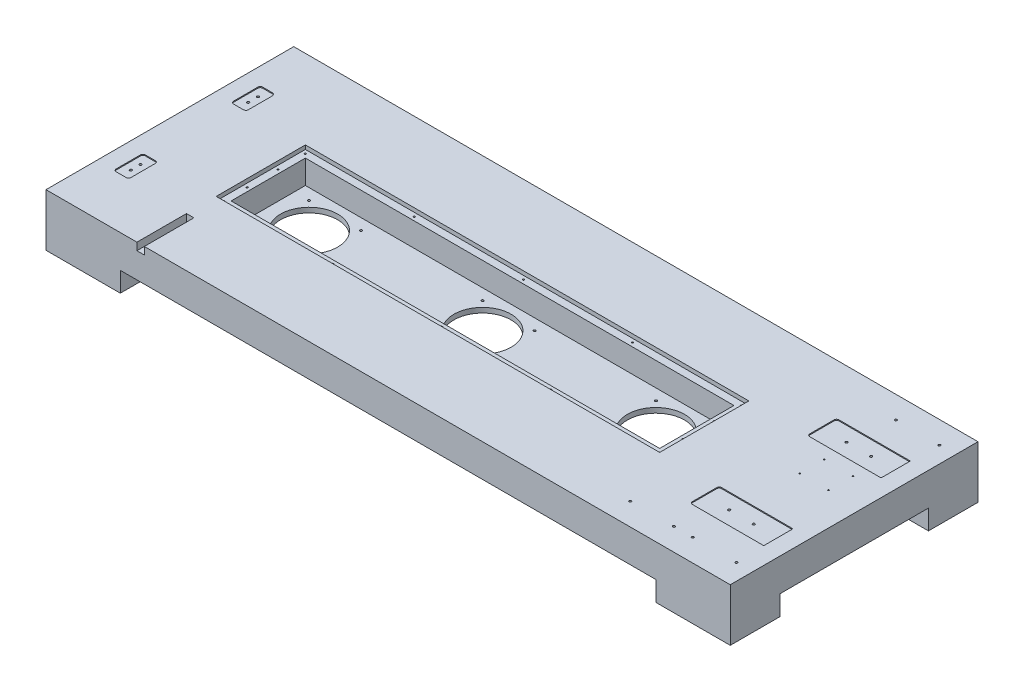
from build123d import *

# Parameters (mm, degrees)
SKETCH19_W               = 895
SKETCH19_H               = 180
SKETCH19_W_2             = 865
SKETCH19_H_2             = 150
BOSS_EXTRUDE2_DEPTH      = 48
SKETCH22_W               = 895
SKETCH22_H               = 180
BOSS_EXTRUDE3_DEPTH      = 10
BOSS_EXTRUDE4_DEPTH      = 56
BOSS_EXTRUDE4_DEPTH_BACK = 10
SKETCH23_W               = 1500
SKETCH23_H               = 500
SKETCH23_W_2             = 895
SKETCH23_H_2             = 180
CUT_EXTRUDE6_START       = 48
SKETCH26_R               = 1.65
CUT_EXTRUDE6_DEPTH       = 20
LPATTERN1_COUNT          = 5
LPATTERN1_PITCH          = 220
SKETCH28_R               = 2.3
SKETCH28_R_2             = 57.7
CUT_EXTRUDE7_DEPTH       = 793.55031386
LPATTERN2_COUNT          = 2
LPATTERN2_PITCH          = 350
LPATTERN2_COL_COUNT      = 2
LPATTERN2_COL_PITCH      = 350
CUT_EXTRUDE8_START       = 48
SKETCH27_R               = 1.65
CUT_EXTRUDE8_DEPTH       = 20
CUT_EXTRUDE9_START       = -56
CUT_EXTRUDE9_DEPTH       = 2
CUT_EXTRUDE10_START      = 56
CUT_EXTRUDE10_DEPTH      = 2
CUT_EXTRUDE11_DEPTH      = 793.55031386
CUT_EXTRUDE11_DEPTH_BACK = 793.55031386
SKETCH33_R               = 2.35
CUT_EXTRUDE12_DEPTH      = 793.55031386
CUT_EXTRUDE12_DEPTH_BACK = 793.55031386
SKETCH34_W               = 190.830831748
SKETCH34_H               = 540.530008981
SKETCH29_W               = 150
SKETCH29_H               = 100
BOSS_EXTRUDE5_DEPTH      = 50
CUT_EXTRUDE13_START      = 56
SKETCH35_W               = 15
SKETCH35_H               = 100
CUT_EXTRUDE13_DEPTH      = 15
SKETCH36_R               = 1.3
CUT_EXTRUDE14_DEPTH      = 10
SKETCH37_R               = 2.25
CUT_EXTRUDE15_DEPTH      = 10


with BuildPart() as part:
    # Sketch19 → Boss-Extrude2 (new body)
    with BuildSketch(Plane(origin=(0, 0, 0), x_dir=(1, 0, 0), z_dir=(0, 1, 0))):
        Rectangle(SKETCH19_W, SKETCH19_H)
        Rectangle(SKETCH19_W_2, SKETCH19_H_2, mode=Mode.SUBTRACT)
    extrude(amount=BOSS_EXTRUDE2_DEPTH)

    # Sketch22 → Boss-Extrude3 (add)
    with BuildSketch(Plane(origin=(0, 0, 0), x_dir=(1, 0, 0), z_dir=(0, 1, 0))):
        Rectangle(SKETCH22_W, SKETCH22_H)
    extrude(amount=-BOSS_EXTRUDE3_DEPTH)

    # Sketch23 → Boss-Extrude4 (add, two sides: drawn at the far end of the back side and taken through both)
    with BuildSketch(Plane(origin=(0, 0, 0), x_dir=(1, 0, 0), z_dir=(0, 1, 0)).offset(-BOSS_EXTRUDE4_DEPTH_BACK)):
        Rectangle(SKETCH23_W, SKETCH23_H)
        Rectangle(SKETCH23_W_2, SKETCH23_H_2, mode=Mode.SUBTRACT)
    extrude(amount=BOSS_EXTRUDE4_DEPTH + BOSS_EXTRUDE4_DEPTH_BACK)

    # Sketch26 → Cut-Extrude6 (cut)
    with BuildSketch(Plane(origin=(0, 0, 0), x_dir=(1, 0, 0), z_dir=(0, 1, 0)).offset(CUT_EXTRUDE6_START)):
        with Locations(Location((-440, -82.5, 0), (0, 0, 90))):
            Circle(SKETCH26_R)
        with Locations(Location((-440, 82.5, 0), (0, 0, 90))):
            Circle(SKETCH26_R)
    cut_extrude6 = extrude(amount=-CUT_EXTRUDE6_DEPTH, mode=Mode.SUBTRACT)

    # LPattern1: Cut-Extrude6 ×5
    with Locations(*[(i * LPATTERN1_PITCH, 0, 0) for i in range(1, LPATTERN1_COUNT)]):
        add(cut_extrude6, mode=Mode.SUBTRACT)

    # Sketch28 → Cut-Extrude7 (cut, symmetric)
    with BuildSketch(Plane(origin=(0, 0, 0), x_dir=(1, 0, 0), z_dir=(0, 1, 0))):
        with Locations(Location((-52.5, 52.5, 0), (0, 0, 270))):
            Circle(SKETCH28_R)
        with Locations(Location((52.5, 52.5, 0), (0, 0, 270))):
            Circle(SKETCH28_R)
        with Locations(Location((52.5, -52.5, 0), (0, 0, 270))):
            Circle(SKETCH28_R)
        with Locations(Location((-52.5, -52.5, 0), (0, 0, 270))):
            Circle(SKETCH28_R)
        with Locations(Location((0, 0, 0), (0, 0, 270))):
            Circle(SKETCH28_R_2)
    cut_extrude7 = extrude(amount=CUT_EXTRUDE7_DEPTH, both=True, mode=Mode.SUBTRACT)

    # LPattern2: Cut-Extrude7 ×2
    with Locations(*[(-i * LPATTERN2_PITCH, 0, 0) for i in range(1, LPATTERN2_COUNT)]):
        add(cut_extrude7, mode=Mode.SUBTRACT)

    # LPattern2 col: Cut-Extrude7 ×2
    with Locations(*[(i * LPATTERN2_COL_PITCH, 0, 0) for i in range(1, LPATTERN2_COL_COUNT)]):
        add(cut_extrude7, mode=Mode.SUBTRACT)

    # Sketch27 → Cut-Extrude8 (cut)
    with BuildSketch(Plane(origin=(0, 0, 0), x_dir=(1, 0, 0), z_dir=(0, 1, 0)).offset(CUT_EXTRUDE8_START)):
        with Locations(Location((-440, 27.5, 0), (0, 0, 90))):
            Circle(SKETCH27_R)
        with Locations(Location((-440, -35, 0), (0, 0, 90))):
            Circle(SKETCH27_R)
        with Locations(Location((440, -35, 0), (0, 0, 90))):
            Circle(SKETCH27_R)
        with Locations(Location((440, 27.5, 0), (0, 0, 90))):
            Circle(SKETCH27_R)
    extrude(amount=-CUT_EXTRUDE8_DEPTH, mode=Mode.SUBTRACT)

    # Sketch30 → Cut-Extrude9 (cut)
    with BuildSketch(Plane.XZ.offset(CUT_EXTRUDE9_START)):
        with BuildLine():
            Line((571.5, -147.92), (714.5, -147.92))
            ThreePointArc((714.5, -147.92), (715.207106781, -147.627106781), (715.5, -146.92))
            Line((715.5, -146.92), (715.5, -89.92))
            ThreePointArc((715.5, -89.92), (715.207106781, -89.212893219), (714.5, -88.92))
            Line((714.5, -88.92), (571.5, -88.92))
            ThreePointArc((571.5, -88.92), (567.964466094, -90.384466094), (566.5, -93.92))
            Line((566.5, -93.92), (566.5, -142.92))
            ThreePointArc((566.5, -142.92), (567.964466094, -146.455533906), (571.5, -147.92))
        make_face()
    cut_extrude9 = extrude(amount=CUT_EXTRUDE9_DEPTH, mode=Mode.SUBTRACT)

    # Mirror1: Cut-Extrude9 across plane
    add(cut_extrude9.mirror(Plane.XY), mode=Mode.SUBTRACT)

    # Sketch32 → Cut-Extrude10 (cut)
    with BuildSketch(Plane(origin=(0, 0, 0), x_dir=(1, 0, 0), z_dir=(0, 1, 0)).offset(CUT_EXTRUDE10_START)):
        with BuildLine():
            Line((-591.5, 147.92), (-571.5, 147.92))
            ThreePointArc((-571.5, 147.92), (-567.964466094, 146.455533906), (-566.5, 142.92))
            Line((-566.5, 142.92), (-566.5, 93.92))
            ThreePointArc((-566.5, 93.92), (-567.964466094, 90.384466094), (-571.5, 88.92))
            Line((-571.5, 88.92), (-591.5, 88.92))
            ThreePointArc((-591.5, 88.92), (-595.035533906, 90.384466094), (-596.5, 93.92))
            Line((-596.5, 93.92), (-596.5, 142.92))
            ThreePointArc((-596.5, 142.92), (-595.035533906, 146.455533906), (-591.5, 147.92))
        make_face()
    cut_extrude10 = extrude(amount=-CUT_EXTRUDE10_DEPTH, mode=Mode.SUBTRACT)

    # Mirror2: Cut-Extrude10 across plane
    add(cut_extrude10.mirror(Plane.XY), mode=Mode.SUBTRACT)

    # Sketch33 → Cut-Extrude11 (cut, two sides: drawn at the far end of the back side and taken through both)
    with BuildSketch(Plane(origin=(0, 0, 0), x_dir=(1, 0, 0), z_dir=(0, 1, 0)).offset(-CUT_EXTRUDE11_DEPTH_BACK)):
        with Locations(Location((-581.5, 108.58, 0), (0, 0, 270))):
            Circle(SKETCH33_R)
        with Locations(Location((-581.5, -108.59, 0), (0, 0, 270))):
            Circle(SKETCH33_R)
        with Locations(Location((-581.5, 128.25, 0), (0, 0, 270))):
            Circle(SKETCH33_R)
        with Locations(Location((-581.5, -128.26, 0), (0, 0, 270))):
            Circle(SKETCH33_R)
        with Locations(Location((616.17, -118.42, 0), (0, 0, 270))):
            Circle(SKETCH33_R)
        with Locations(Location((665.84, -118.42, 0), (0, 0, 270))):
            Circle(SKETCH33_R)
        with Locations(Location((616.17, 118.42, 0), (0, 0, 270))):
            Circle(SKETCH33_R)
        with Locations(Location((665.84, 118.42, 0), (0, 0, 270))):
            Circle(SKETCH33_R)
    extrude(amount=CUT_EXTRUDE11_DEPTH + CUT_EXTRUDE11_DEPTH_BACK, mode=Mode.SUBTRACT)

    # Sketch34 → Cut-Extrude12 (cut, two sides: drawn at the far end of the back side and taken through both)
    with BuildSketch(Plane(origin=(0, 0, 0), x_dir=(1, 0, 0), z_dir=(0, 1, 0)).offset(-CUT_EXTRUDE12_DEPTH_BACK)):
        with Locations((-726.415415874, 20.265004491)):
            Rectangle(SKETCH34_W, SKETCH34_H)
    extrude(amount=CUT_EXTRUDE12_DEPTH + CUT_EXTRUDE12_DEPTH_BACK, mode=Mode.SUBTRACT)

    # Sketch29 → Boss-Extrude5 (add)
    with BuildSketch(Plane(origin=(0, 0, 0), x_dir=(1, 0, 0), z_dir=(0, 1, 0))):
        with Locations((-556, -200)):
            Rectangle(SKETCH29_W, SKETCH29_H)
        with Locations((-556, 200)):
            Rectangle(SKETCH29_W, SKETCH29_H)
        with Locations((675, -200)):
            Rectangle(SKETCH29_W, SKETCH29_H)
        with Locations((675, 200)):
            Rectangle(SKETCH29_W, SKETCH29_H)
    extrude(amount=-BOSS_EXTRUDE5_DEPTH)

    # Sketch35 → Cut-Extrude13 (cut)
    with BuildSketch(Plane(origin=(0, 0, 0), x_dir=(1, 0, 0), z_dir=(0, 1, 0)).offset(CUT_EXTRUDE13_START)):
        with Locations((-440, -200)):
            Rectangle(SKETCH35_W, SKETCH35_H)
    extrude(amount=-CUT_EXTRUDE13_DEPTH, mode=Mode.SUBTRACT)

    # Sketch36 → Cut-Extrude14 (cut)
    with BuildSketch(Plane(origin=(0, 56, 0), x_dir=(-1, 0, 0), z_dir=(0, 1, 0))):
        with Locations(Location((-683.996319, -14.497340105, 0), (0, 0, 90))):
            Circle(SKETCH36_R)
        with Locations(Location((-683.996319, -63.497340105, 0), (0, 0, 90))):
            Circle(SKETCH36_R)
        with Locations(Location((-625.996319, -63.497340105, 0), (0, 0, 90))):
            Circle(SKETCH36_R)
        with Locations(Location((-625.996319, -14.497340105, 0), (0, 0, 90))):
            Circle(SKETCH36_R)
    extrude(amount=-CUT_EXTRUDE14_DEPTH, mode=Mode.SUBTRACT)

    # Sketch37 → Cut-Extrude15 (cut)
    with BuildSketch(Plane(origin=(0, 56, 0), x_dir=(1, 0, 0), z_dir=(0, 1, 0))):
        with Locations(Location((717.160651903, -205, 0), (0, 0, 270))):
            Circle(SKETCH37_R)
        with Locations(Location((629.160651903, -205, 0), (0, 0, 270))):
            Circle(SKETCH37_R)
        with Locations(Location((591.138632586, -205, 0), (0, 0, 270))):
            Circle(SKETCH37_R)
        with Locations(Location((503.138632586, -205, 0), (0, 0, 270))):
            Circle(SKETCH37_R)
        with Locations(Location((717.160651903, 205, 0), (0, 0, 270))):
            Circle(SKETCH37_R)
        with Locations(Location((629.160651903, 205, 0), (0, 0, 270))):
            Circle(SKETCH37_R)
    extrude(amount=-CUT_EXTRUDE15_DEPTH, mode=Mode.SUBTRACT)


solid = part.part
